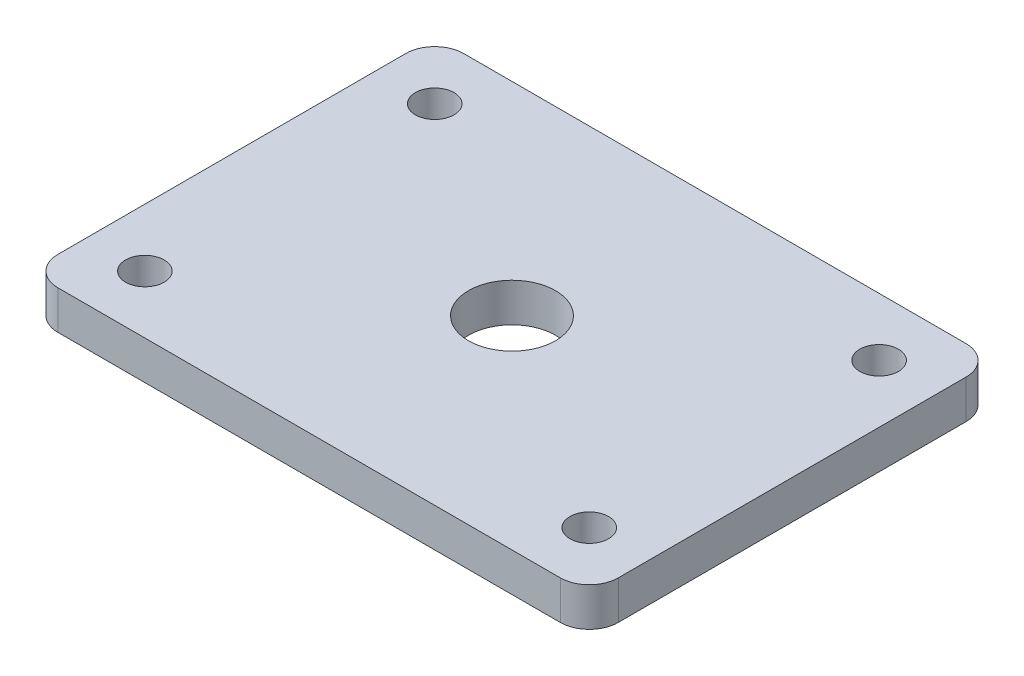
from build123d import *

# Parameters (mm, degrees)
SKETCH1_W           = 58
SKETCH1_H           = 42
SKETCH1_R           = 2
SKETCH1_R_2         = 4.5
BOSS_EXTRUDE1_DEPTH = 4
FILLET1_R           = 3


with BuildPart() as part:
    # Sketch1 → Boss-Extrude1 (new body)
    with BuildSketch(Plane(origin=(0, 0, 0), x_dir=(1, 0, 0), z_dir=(0, 1, 0))):
        Rectangle(SKETCH1_W, SKETCH1_H)
        with Locations(Location((-23, 15, 0), (0, 0, 270))):
            Circle(SKETCH1_R, mode=Mode.SUBTRACT)
        with Locations(Location((23, 15, 0), (0, 0, 270))):
            Circle(SKETCH1_R, mode=Mode.SUBTRACT)
        with Locations(Location((23, -15, 0), (0, 0, 270))):
            Circle(SKETCH1_R, mode=Mode.SUBTRACT)
        with Locations(Location((-23, -15, 0), (0, 0, 270))):
            Circle(SKETCH1_R, mode=Mode.SUBTRACT)
        with Locations(Location((0, 0, 0), (0, 0, 270))):
            Circle(SKETCH1_R_2, mode=Mode.SUBTRACT)
    extrude(amount=BOSS_EXTRUDE1_DEPTH)

    # Fillet1
    fillet1_edges = [part.edges().sort_by_distance(p)[0] for p in [
        (29, 2, 21),
        (-29, 2, 21),
        (-29, 2, -21),
        (29, 2, -21),
    ]]
    fillet(fillet1_edges, radius=FILLET1_R)


solid = part.part
